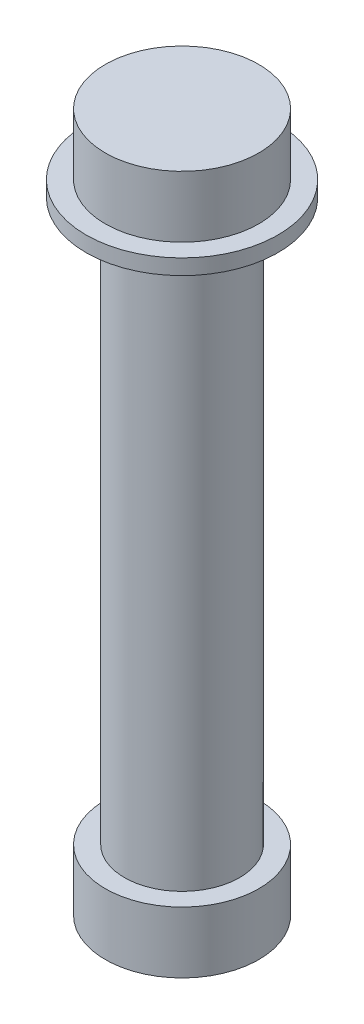
from build123d import *

# Parameters (mm, degrees)
SKETCH1_R           = 4.7625
BOSS_EXTRUDE1_DEPTH = 46.355
SKETCH2_R           = 7.9375
BOSS_EXTRUDE2_DEPTH = 1.27
SKETCH3_R           = 6.35
BOSS_EXTRUDE3_DEPTH = 5.08
BOSS_EXTRUDE4_START = 5.08
SKETCH4_R           = 6.35
BOSS_EXTRUDE4_DEPTH = 5.08


with BuildPart() as part:
    # Sketch1 → Boss-Extrude1 (new body)
    with BuildSketch(Plane(origin=(0, 0, 0), x_dir=(1, 0, 0), z_dir=(0, 1, 0))):
        with Locations(Location((0, 0, 0), (0, 0, 90))):
            Circle(SKETCH1_R)
    extrude(amount=BOSS_EXTRUDE1_DEPTH)

    # Sketch2 → Boss-Extrude2 (add)
    with BuildSketch(Plane(origin=(0, 46.355, 0), x_dir=(1, 0, 0), z_dir=(0, 1, 0))):
        with Locations(Location((0, 0, 0), (0, 0, 270))):
            Circle(SKETCH2_R)
    extrude(amount=BOSS_EXTRUDE2_DEPTH)

    # Sketch3 → Boss-Extrude3 (add)
    with BuildSketch(Plane.XZ):
        with Locations(Location((0, 0, 0), (0, 0, 270))):
            Circle(SKETCH3_R)
    extrude(amount=BOSS_EXTRUDE3_DEPTH)

    # Sketch4 → Boss-Extrude4 (add)
    with BuildSketch(Plane(origin=(0, 47.625, 0), x_dir=(1, 0, 0), z_dir=(0, 1, 0)).offset(BOSS_EXTRUDE4_START)):
        with Locations(Location((0, 0, 0), (0, 0, 90))):
            Circle(SKETCH4_R)
    extrude(amount=-BOSS_EXTRUDE4_DEPTH)


solid = part.part
